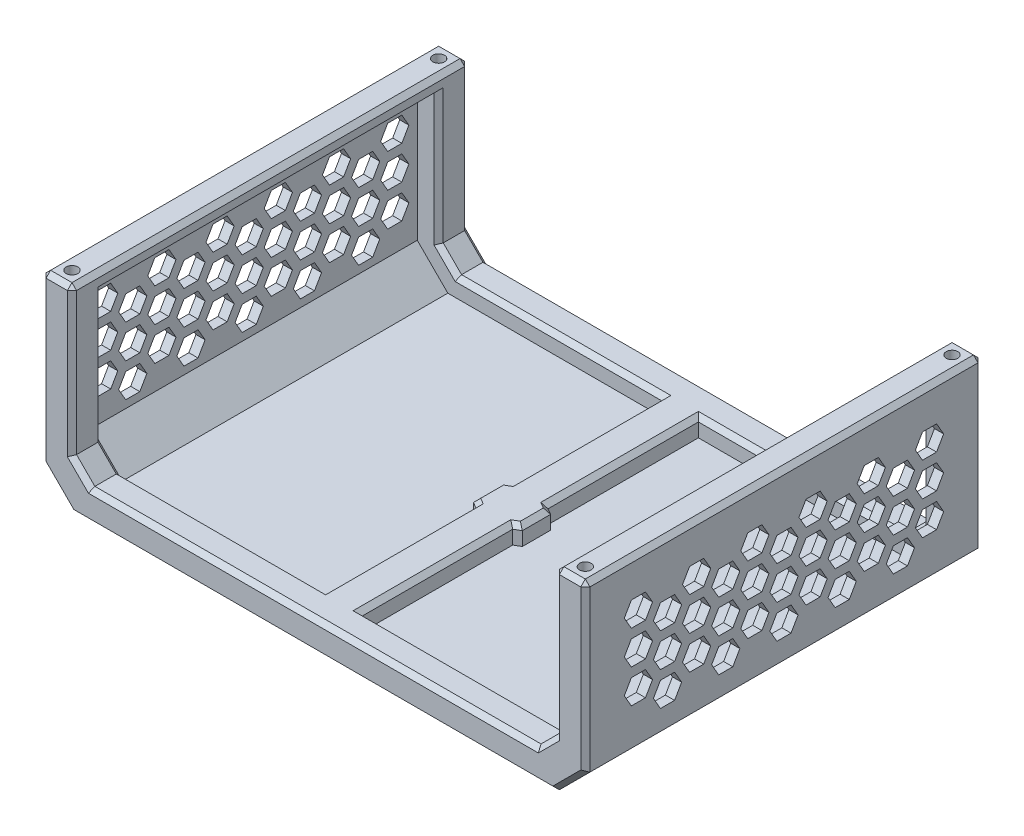
from build123d import *

# Parameters (mm, degrees)
EXTRUDE_2_DEPTH             = 130
SKETCH_3_W                  = 10
SKETCH_3_H                  = 10
EXTRUDE_3_DEPTH             = 60
SKETCH_4_R                  = 1.9
CUT_EXTRUDE_1_DEPTH         = 8
CHAMFER_1_SIZE              = 10
CHAMFER_2_SIZE              = 10
EXTRUDE_4_REACH             = 170.585
SKETCH_6_W                  = 10
SKETCH_6_H                  = 10
EXTRUDE_4_DIRECTION_2_REACH = 170.585
CHAMFER_3_SIZE              = 6
EXTRUDE_6_REACH             = 163
SKETCH_17_W                 = 12
SKETCH_17_H                 = 110
EXTRUDE_7_DEPTH             = 6
SKETCH_20_R                 = 3.05
CUT_EXTRUDE_3_DEPTH         = 6.5
EXTRUDE_START               = -6
SKETCH_21_R                 = 3.05
EXTRUDE_9_DEPTH             = 6
CUT_EXTRUDE_5_DEPTH         = 229.438175444
CHAMFER_4_SIZE              = 1.5
CHAMFER_6_SIZE              = 1.5
CHAMFER_7_SIZE              = 1.5
CHAMFER_8_SIZE              = 1


with BuildPart() as part:
    # 草图1 → 凸台-拉伸2 (new body)
    with BuildSketch(Plane.XY):
        Polygon((-86, 0), (86, 0), (86, 60), (89, 60), (89, -4), (-89, -4), (-89, 60), (-86, 60), align=None)
    extrude(amount=EXTRUDE_2_DEPTH)

    # 草图3 → 凸台-拉伸3 (add)
    with BuildSketch(Plane(origin=(0, 60, 0), x_dir=(1, 0, 0), z_dir=(0, 1, 0))):
        with Locations((-84, -5)):
            Rectangle(SKETCH_3_W, SKETCH_3_H)
        with Locations((84, -5)):
            Rectangle(SKETCH_3_W, SKETCH_3_H)
        with Locations((84, -125)):
            Rectangle(SKETCH_3_W, SKETCH_3_H)
        with Locations((-84, -125)):
            Rectangle(SKETCH_3_W, SKETCH_3_H)
    extrude(amount=-EXTRUDE_3_DEPTH)

    # 草图4 → 切除-拉伸1 (cut)
    with BuildSketch(Plane(origin=(0, 60, 0), x_dir=(1, 0, 0), z_dir=(0, 1, 0))):
        with Locations(Location((-84, -5, 0), (0, 0, 270))):
            Circle(SKETCH_4_R)
        with Locations(Location((84, -5, 0), (0, 0, 270))):
            Circle(SKETCH_4_R)
        with Locations(Location((84, -125, 0), (0, 0, 270))):
            Circle(SKETCH_4_R)
        with Locations(Location((-84, -125, 0), (0, 0, 270))):
            Circle(SKETCH_4_R)
    extrude(amount=-CUT_EXTRUDE_1_DEPTH, mode=Mode.SUBTRACT)

    # 倒角1
    chamfer_1_edges = [part.edges().sort_by_distance(p)[0] for p in [
        (86, 0, 65),
        (-86, 0, 65),
    ]]
    chamfer(chamfer_1_edges, length=CHAMFER_1_SIZE)

    # 倒角2
    chamfer_2_edges = [part.edges().sort_by_distance(p)[0] for p in [
        (89, -4, 65),
        (-89, -4, 65),
    ]]
    chamfer(chamfer_2_edges, length=CHAMFER_2_SIZE)

    # 凸台-拉伸4: up to this face of the body (flat: up to its plane)
    extrude_4_end = Plane(part.part.faces().sort_by_distance((79, 31.5, 125))[0])
    # 草图6 → 凸台-拉伸4 (add, up to the picked face)
    with BuildSketch(Plane(origin=(0, 0, 0), x_dir=(0, 0, -1), z_dir=(1, 0, 0)), mode=Mode.PRIVATE) as extrude_4_sk1:
        with Locations((-125, 1)):
            Rectangle(SKETCH_6_W, SKETCH_6_H)
    extrude_4_tool1 = split(extrude(extrude_4_sk1.sketch, amount=EXTRUDE_4_REACH, mode=Mode.PRIVATE), bisect_by=extrude_4_end, keep=Keep.BOTH, mode=Mode.PRIVATE)
    # 草图6 → 凸台-拉伸4 (add, up to the picked face)
    with BuildSketch(Plane(origin=(0, 0, 0), x_dir=(0, 0, -1), z_dir=(1, 0, 0)), mode=Mode.PRIVATE) as extrude_4_sk2:
        with Locations((-5, 1)):
            Rectangle(SKETCH_6_W, SKETCH_6_H)
    extrude_4_tool2 = split(extrude(extrude_4_sk2.sketch, amount=EXTRUDE_4_REACH, mode=Mode.PRIVATE), bisect_by=extrude_4_end, keep=Keep.BOTH, mode=Mode.PRIVATE)
    add(extrude_4_tool1.solids().sort_by(Axis((0, 1, 125), (1, 0, 0)))[0])
    add(extrude_4_tool2.solids().sort_by(Axis((0, 1, 5), (1, 0, 0)))[0])

    # 凸台-拉伸4 direction 2: up to this face of the body (flat: up to its plane)
    extrude_4_direction_2_end = Plane(part.part.faces().sort_by_distance((-79, 31.5, 125))[0])
    # 草图6 → 凸台-拉伸4 direction 2 (add, up to the picked face)
    with BuildSketch(Plane(origin=(0, 0, 0), x_dir=(0, 0, -1), z_dir=(1, 0, 0)), mode=Mode.PRIVATE) as extrude_4_direction_2_sk1:
        with Locations((-125, 1)):
            Rectangle(SKETCH_6_W, SKETCH_6_H)
    extrude_4_direction_2_tool1 = split(extrude(extrude_4_direction_2_sk1.sketch, amount=-EXTRUDE_4_DIRECTION_2_REACH, mode=Mode.PRIVATE), bisect_by=extrude_4_direction_2_end, keep=Keep.BOTH, mode=Mode.PRIVATE)
    # 草图6 → 凸台-拉伸4 direction 2 (add, up to the picked face)
    with BuildSketch(Plane(origin=(0, 0, 0), x_dir=(0, 0, -1), z_dir=(1, 0, 0)), mode=Mode.PRIVATE) as extrude_4_direction_2_sk2:
        with Locations((-5, 1)):
            Rectangle(SKETCH_6_W, SKETCH_6_H)
    extrude_4_direction_2_tool2 = split(extrude(extrude_4_direction_2_sk2.sketch, amount=-EXTRUDE_4_DIRECTION_2_REACH, mode=Mode.PRIVATE), bisect_by=extrude_4_direction_2_end, keep=Keep.BOTH, mode=Mode.PRIVATE)
    add(extrude_4_direction_2_tool1.solids().sort_by(Axis((0, 1, 125), (-1, 0, 0)))[0])
    add(extrude_4_direction_2_tool2.solids().sort_by(Axis((0, 1, 5), (-1, 0, 0)))[0])

    # 倒角3
    chamfer_3_edges = [part.edges().sort_by_distance(p)[0] for p in [
        (-79, 6, 125),
        (79, 6, 125),
        (-79, 6, 5),
        (79, 6, 5),
    ]]
    chamfer(chamfer_3_edges, length=CHAMFER_3_SIZE)

    # 草图10 → 凸台-拉伸6 (add, up to next)
    with BuildSketch(Plane.XY.offset(10), mode=Mode.PRIVATE) as extrude_6_sk1:
        Polygon((86, 60), (79, 60), (79, 55), (86, 50), align=None)
    extrude_6_tool1 = extrude(extrude_6_sk1.sketch, amount=EXTRUDE_6_REACH, mode=Mode.PRIVATE) - part.part
    # 草图10 → 凸台-拉伸6 (add, up to next)
    with BuildSketch(Plane.XY.offset(10), mode=Mode.PRIVATE) as extrude_6_sk2:
        Polygon((-86, 60), (-79, 60), (-79, 56), (-86, 50), align=None)
    extrude_6_tool2 = extrude(extrude_6_sk2.sketch, amount=EXTRUDE_6_REACH, mode=Mode.PRIVATE) - part.part
    add(extrude_6_tool1.solids().sort_by_distance((82.888889, 56.111111, 10))[0])
    add(extrude_6_tool2.solids().sort_by_distance((-83, 56.285714, 10))[0])

    # 草图17 → 凸台-拉伸7 (add)
    with BuildSketch(Plane(origin=(0, 0, 0), x_dir=(1, 0, 0), z_dir=(0, 1, 0))):
        with Locations((0, -65)):
            Rectangle(SKETCH_17_W, SKETCH_17_H)
    extrude(amount=EXTRUDE_7_DEPTH)

    # 草图20 → 切除-拉伸3 (cut)
    with BuildSketch(Plane(origin=(0, -4, 0), x_dir=(-1, 0, 0), z_dir=(0, -1, 0))):
        with Locations(Location((0, -65, 0), (0, 0, 90))):
            Circle(SKETCH_20_R)
    extrude(amount=-CUT_EXTRUDE_3_DEPTH, mode=Mode.SUBTRACT)

    # 草图21 → 凸台-拉伸9 (add)
    with BuildSketch(Plane(origin=(0, 6, 0), x_dir=(1, 0, 0), z_dir=(0, 1, 0)).offset(EXTRUDE_START)):
        Polygon((0, -55.762395693), (-8, -60.381197846), (-8, -69.618802154), (0, -74.237604307), (8, -69.618802154), (8, -60.381197846), align=None)
        with Locations(Location((0, -65, 0), (0, 0, 90))):
            Circle(SKETCH_21_R, mode=Mode.SUBTRACT)
    extrude(amount=EXTRUDE_9_DEPTH)

    # 草图22 → 切除-拉伸5 (cut, through all)
    with BuildSketch(Plane(origin=(89, 0, 0), x_dir=(0, 0, -1), z_dir=(1, 0, 0))):
        Polygon((-108.012595055, 44), (-110.321996131, 48), (-114.940798285, 48), (-117.250199362, 44), (-114.940798285, 40), (-110.321996131, 40), align=None)
        Polygon((-91.269437248, 48), (-95.888239402, 48), (-98.197640478, 44), (-95.888239402, 40), (-91.269437248, 40), (-88.960036171, 44), align=None)
        Polygon((-81.743157806, 42.5), (-86.36195996, 42.5), (-88.671361037, 38.5), (-86.36195996, 34.5), (-81.743157806, 34.5), (-79.43375673, 38.5), align=None)
        Polygon((-98.486315613, 38.5), (-100.79571669, 42.5), (-105.414518843, 42.5), (-107.72391992, 38.5), (-105.414518843, 34.5), (-100.79571669, 34.5), align=None)
        Polygon((-72.216878365, 48), (-76.835680518, 48), (-79.145081595, 44), (-76.835680518, 40), (-72.216878365, 40), (-69.907477288, 44), align=None)
        Polygon((-53.164319482, 48), (-57.783121635, 48), (-60.092522712, 44), (-57.783121635, 40), (-53.164319482, 40), (-50.854918405, 44), align=None)
        Polygon((-34.111760598, 48), (-38.730562752, 48), (-41.039963829, 44), (-38.730562752, 40), (-34.111760598, 40), (-31.802359522, 44), align=None)
        Polygon((-15.059201715, 48), (-19.678003869, 48), (-21.987404945, 44), (-19.678003869, 40), (-15.059201715, 40), (-12.749800638, 44), align=None)
        Polygon((-62.690598923, 42.5), (-67.309401077, 42.5), (-69.618802154, 38.5), (-67.309401077, 34.5), (-62.690598923, 34.5), (-60.381197846, 38.5), align=None)
        Polygon((-43.63804004, 42.5), (-48.256842194, 42.5), (-50.56624327, 38.5), (-48.256842194, 34.5), (-43.63804004, 34.5), (-41.328638963, 38.5), align=None)
        Polygon((-24.585481157, 42.5), (-29.20428331, 42.5), (-31.513684387, 38.5), (-29.20428331, 34.5), (-24.585481157, 34.5), (-22.27608008, 38.5), align=None)
        Polygon((-108.012595055, 33), (-110.321996131, 37), (-114.940798285, 37), (-117.250199362, 33), (-114.940798285, 29), (-110.321996131, 29), align=None)
        Polygon((-91.269437248, 37), (-95.888239402, 37), (-98.197640478, 33), (-95.888239402, 29), (-91.269437248, 29), (-88.960036171, 33), align=None)
        Polygon((-81.743157806, 31.5), (-86.36195996, 31.5), (-88.671361037, 27.5), (-86.36195996, 23.5), (-81.743157806, 23.5), (-79.43375673, 27.5), align=None)
        Polygon((-98.486315613, 27.5), (-100.79571669, 31.5), (-105.414518843, 31.5), (-107.72391992, 27.5), (-105.414518843, 23.5), (-100.79571669, 23.5), align=None)
        Polygon((-72.216878365, 37), (-76.835680518, 37), (-79.145081595, 33), (-76.835680518, 29), (-72.216878365, 29), (-69.907477288, 33), align=None)
        Polygon((-53.164319482, 37), (-57.783121635, 37), (-60.092522712, 33), (-57.783121635, 29), (-53.164319482, 29), (-50.854918405, 33), align=None)
        Polygon((-34.111760598, 37), (-38.730562752, 37), (-41.039963829, 33), (-38.730562752, 29), (-34.111760598, 29), (-31.802359522, 33), align=None)
        Polygon((-15.059201715, 37), (-19.678003869, 37), (-21.987404945, 33), (-19.678003869, 29), (-15.059201715, 29), (-12.749800638, 33), align=None)
        Polygon((-62.690598923, 31.5), (-67.309401077, 31.5), (-69.618802154, 27.5), (-67.309401077, 23.5), (-62.690598923, 23.5), (-60.381197846, 27.5), align=None)
        Polygon((-43.63804004, 31.5), (-48.256842194, 31.5), (-50.56624327, 27.5), (-48.256842194, 23.5), (-43.63804004, 23.5), (-41.328638963, 27.5), align=None)
        Polygon((-24.585481157, 31.5), (-29.20428331, 31.5), (-31.513684387, 27.5), (-29.20428331, 23.5), (-24.585481157, 23.5), (-22.27608008, 27.5), align=None)
        Polygon((-108.012595055, 22), (-110.321996131, 26), (-114.940798285, 26), (-117.250199362, 22), (-114.940798285, 18), (-110.321996131, 18), align=None)
        Polygon((-91.269437248, 26), (-95.888239402, 26), (-98.197640478, 22), (-95.888239402, 18), (-91.269437248, 18), (-88.960036171, 22), align=None)
        Polygon((-81.743157806, 20.5), (-86.36195996, 20.5), (-88.671361037, 16.5), (-86.36195996, 12.5), (-81.743157806, 12.5), (-79.43375673, 16.5), align=None)
        Polygon((-98.486315613, 16.5), (-100.79571669, 20.5), (-105.414518843, 20.5), (-107.72391992, 16.5), (-105.414518843, 12.5), (-100.79571669, 12.5), align=None)
        Polygon((-72.216878365, 26), (-76.835680518, 26), (-79.145081595, 22), (-76.835680518, 18), (-72.216878365, 18), (-69.907477288, 22), align=None)
        Polygon((-53.164319482, 26), (-57.783121635, 26), (-60.092522712, 22), (-57.783121635, 18), (-53.164319482, 18), (-50.854918405, 22), align=None)
        Polygon((-34.111760598, 26), (-38.730562752, 26), (-41.039963829, 22), (-38.730562752, 18), (-34.111760598, 18), (-31.802359522, 22), align=None)
        Polygon((-15.059201715, 26), (-19.678003869, 26), (-21.987404945, 22), (-19.678003869, 18), (-15.059201715, 18), (-12.749800638, 22), align=None)
        Polygon((-62.690598923, 20.5), (-67.309401077, 20.5), (-69.618802154, 16.5), (-67.309401077, 12.5), (-62.690598923, 12.5), (-60.381197846, 16.5), align=None)
        Polygon((-43.63804004, 20.5), (-48.256842194, 20.5), (-50.56624327, 16.5), (-48.256842194, 12.5), (-43.63804004, 12.5), (-41.328638963, 16.5), align=None)
        Polygon((-24.585481157, 20.5), (-29.20428331, 20.5), (-31.513684387, 16.5), (-29.20428331, 12.5), (-24.585481157, 12.5), (-22.27608008, 16.5), align=None)
    extrude(amount=-CUT_EXTRUDE_5_DEPTH, mode=Mode.SUBTRACT)

    # 倒角4
    chamfer_4_edges = [part.edges().sort_by_distance(p)[0] for p in [
        (-84, 60, 0),
        (89, 33, 130),
        (89, 33, 0),
        (0, -4, 0),
        (-84, 1, 0),
        (89, 60, 65),
        (84, 1, 0),
        (0, -4, 130),
        (-89, 60, 65),
        (-84, 1, 130),
        (84, 1, 130),
        (-84, 60, 130),
        (-79, 36, 0),
        (0, 6, 0),
        (79, 36, 0),
        (0, 6, 130),
        (79, 36, 130),
        (-79, 36, 130),
        (-76, 9, 0),
        (-89, 33, 130),
        (76, 9, 0),
        (76, 9, 130),
        (-76, 9, 130),
        (-79, 60, 65),
        (84, 60, 130),
        (79, 60, 65),
        (84, 60, 0),
        (-89, 33, 0),
    ]]
    chamfer(chamfer_4_edges, length=CHAMFER_4_SIZE)

    # 倒角6
    chamfer_6_edges = [part.edges().sort_by_distance(p)[0] for p in [
        (-79, 34, 10),
        (-79, 34, 120),
        (-76, 9, 10),
        (-76, 9, 120),
        (-39.5, 6, 10),
        (-39.5, 6, 120),
        (-6, 6, 95.386751346),
        (-6, 6, 34.613248654),
        (-7, 6, 59.803847577),
        (-8, 6, 65),
        (-7, 6, 70.196152423),
    ]]
    chamfer(chamfer_6_edges, length=CHAMFER_6_SIZE)

    # 倒角7
    chamfer_7_edges = [part.edges().sort_by_distance(p)[0] for p in [
        (39.5, 6, 10),
        (79, 33.5, 10),
        (39.5, 6, 120),
        (79, 33.5, 120),
        (76, 9, 10),
        (76, 9, 120),
        (6, 6, 34.613248654),
        (6, 6, 95.386751346),
        (7, 6, 70.196152423),
        (8, 6, 65),
        (7, 6, 59.803847577),
    ]]
    chamfer(chamfer_7_edges, length=CHAMFER_7_SIZE)

    # 倒角8
    chamfer_8_edges = [part.edges().sort_by_distance(p)[0] for p in [
        (0, -4, 68.05),
    ]]
    chamfer(chamfer_8_edges, length=CHAMFER_8_SIZE)


solid = part.part
